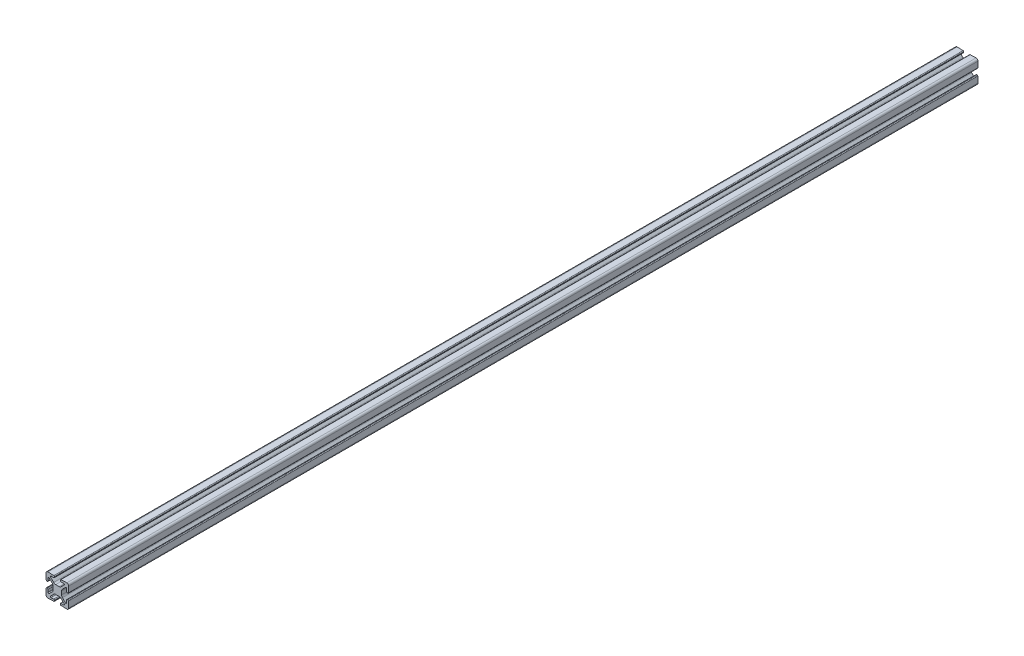
from build123d import *

# Parameters (mm, degrees)
BOSS_EXTRUDE1_DEPTH = 457.2
CIRPATTERN1_COUNT   = 4
BOSS_EXTRUDE2_START = 101.6
BOSS_EXTRUDE2_DEPTH = 101.6


with BuildPart() as part:
    # Sketch3 → Boss-Extrude1 (new, symmetric)
    with BuildSketch(Plane.XY):
        with BuildLine():
            Line((0, 4.7625), (-1.884807374, 4.7625))
            ThreePointArc((-1.884807374, 4.7625), (-3.099827272, 5.004182484), (-4.129871405, 5.69243597))
            Line((-4.129871405, 5.69243597), (-7.599623114, 9.162187679))
            ThreePointArc((-7.599623114, 9.162187679), (-7.759888701, 10.006330839), (-7.033220609, 10.464824259))
            Line((-7.033220609, 10.464824259), (-4.047481702, 10.360559959))
            ThreePointArc((-4.047481702, 10.360559959), (-3.501205536, 10.564804249), (-3.259352476, 11.095502353))
            Line((-3.259352476, 11.095502353), (-3.23896419, 11.679346474))
            ThreePointArc((-3.23896419, 11.679346474), (-3.443208479, 12.225622641), (-3.973906584, 12.467475701))
            Line((-3.973906584, 12.467475701), (-10.597084223, 12.698762161))
            ThreePointArc((-10.597084223, 12.698762161), (-12.104840979, 12.104840979), (-12.698762161, 10.597084223))
            Line((-12.698762161, 10.597084223), (-12.467475701, 3.973906584))
            ThreePointArc((-12.467475701, 3.973906584), (-12.225622641, 3.443208479), (-11.679346474, 3.23896419))
            Line((-11.679346474, 3.23896419), (-11.095502353, 3.259352476))
            ThreePointArc((-11.095502353, 3.259352476), (-10.564804249, 3.501205536), (-10.360559959, 4.047481702))
            Line((-10.360559959, 4.047481702), (-10.464824259, 7.033220609))
            ThreePointArc((-10.464824259, 7.033220609), (-10.006330839, 7.759888701), (-9.162187679, 7.599623114))
            Line((-9.162187679, 7.599623114), (-5.69243597, 4.129871405))
            ThreePointArc((-5.69243597, 4.129871405), (-5.004182484, 3.099827272), (-4.7625, 1.884807374))
            Line((-4.7625, 1.884807374), (-4.7625, 0))
            Line((-4.7625, 0), (-2.54, 0))
            ThreePointArc((-2.54, 0), (-1.796051224, 1.796051224), (0, 2.54))
            Line((0, 2.54), (0, 4.7625))
        make_face()
    boss_extrude1 = extrude(amount=BOSS_EXTRUDE1_DEPTH, both=True)

    # CirPattern1: Boss-Extrude1 ×4 about axis
    cirpattern1_axis = Axis((0, 0, 0), (0, 0, 1))
    for i in range(1, CIRPATTERN1_COUNT):
        add(boss_extrude1.rotate(cirpattern1_axis, i * 360 / CIRPATTERN1_COUNT))

    # Sketch4 → Boss-Extrude2 (add)
    with BuildSketch(Plane.XY.offset(457.2).offset(BOSS_EXTRUDE2_START)):
        with BuildLine():
            Line((1.884807374, 4.7625), (-1.884807374, 4.7625))
            ThreePointArc((-1.884807374, 4.7625), (-3.099827272, 5.004182484), (-4.129871405, 5.69243597))
            Line((-4.129871405, 5.69243597), (-7.599623114, 9.162187679))
            ThreePointArc((-7.599623114, 9.162187679), (-7.759888701, 10.006330839), (-7.033220609, 10.464824259))
            Line((-7.033220609, 10.464824259), (-4.047481702, 10.360559959))
            ThreePointArc((-4.047481702, 10.360559959), (-3.501205536, 10.564804249), (-3.259352476, 11.095502353))
            Line((-3.259352476, 11.095502353), (-3.23896419, 11.679346474))
            ThreePointArc((-3.23896419, 11.679346474), (-3.443208479, 12.225622641), (-3.973906584, 12.467475701))
            Line((-3.973906584, 12.467475701), (-10.597084223, 12.698762161))
            ThreePointArc((-10.597084223, 12.698762161), (-12.104840979, 12.104840979), (-12.698762161, 10.597084223))
            Line((-12.698762161, 10.597084223), (-12.467475701, 3.973906584))
            ThreePointArc((-12.467475701, 3.973906584), (-12.225622641, 3.443208479), (-11.679346474, 3.23896419))
            Line((-11.679346474, 3.23896419), (-11.095502353, 3.259352476))
            ThreePointArc((-11.095502353, 3.259352476), (-10.564804249, 3.501205536), (-10.360559959, 4.047481702))
            Line((-10.360559959, 4.047481702), (-10.464824259, 7.033220609))
            ThreePointArc((-10.464824259, 7.033220609), (-10.006330839, 7.759888701), (-9.162187679, 7.599623114))
            Line((-9.162187679, 7.599623114), (-5.69243597, 4.129871405))
            ThreePointArc((-5.69243597, 4.129871405), (-5.004182484, 3.099827272), (-4.7625, 1.884807374))
            Line((-4.7625, 1.884807374), (-4.7625, -1.884807374))
            ThreePointArc((-4.7625, -1.884807374), (-5.004182484, -3.099827272), (-5.69243597, -4.129871405))
            Line((-5.69243597, -4.129871405), (-9.162187679, -7.599623114))
            ThreePointArc((-9.162187679, -7.599623114), (-10.006330839, -7.759888701), (-10.464824259, -7.033220609))
            Line((-10.464824259, -7.033220609), (-10.360559959, -4.047481702))
            ThreePointArc((-10.360559959, -4.047481702), (-10.564804249, -3.501205536), (-11.095502353, -3.259352476))
            Line((-11.095502353, -3.259352476), (-11.679346474, -3.23896419))
            ThreePointArc((-11.679346474, -3.23896419), (-12.225622641, -3.443208479), (-12.467475701, -3.973906584))
            Line((-12.467475701, -3.973906584), (-12.698762161, -10.597084223))
            ThreePointArc((-12.698762161, -10.597084223), (-12.104840979, -12.104840979), (-10.597084223, -12.698762161))
            Line((-10.597084223, -12.698762161), (-3.973906584, -12.467475701))
            ThreePointArc((-3.973906584, -12.467475701), (-3.443208479, -12.225622641), (-3.23896419, -11.679346474))
            Line((-3.23896419, -11.679346474), (-3.259352476, -11.095502353))
            ThreePointArc((-3.259352476, -11.095502353), (-3.501205536, -10.564804249), (-4.047481702, -10.360559959))
            Line((-4.047481702, -10.360559959), (-7.033220609, -10.464824259))
            ThreePointArc((-7.033220609, -10.464824259), (-7.759888701, -10.006330839), (-7.599623114, -9.162187679))
            Line((-7.599623114, -9.162187679), (-4.129871405, -5.69243597))
            ThreePointArc((-4.129871405, -5.69243597), (-3.099827272, -5.004182484), (-1.884807374, -4.7625))
            Line((-1.884807374, -4.7625), (1.884807374, -4.7625))
            ThreePointArc((1.884807374, -4.7625), (3.099827272, -5.004182484), (4.129871405, -5.69243597))
            Line((4.129871405, -5.69243597), (7.599623114, -9.162187679))
            ThreePointArc((7.599623114, -9.162187679), (7.759888701, -10.006330839), (7.033220609, -10.464824259))
            Line((7.033220609, -10.464824259), (4.047481702, -10.360559959))
            ThreePointArc((4.047481702, -10.360559959), (3.501205536, -10.564804249), (3.259352476, -11.095502353))
            Line((3.259352476, -11.095502353), (3.23896419, -11.679346474))
            ThreePointArc((3.23896419, -11.679346474), (3.443208479, -12.225622641), (3.973906584, -12.467475701))
            Line((3.973906584, -12.467475701), (10.597084223, -12.698762161))
            ThreePointArc((10.597084223, -12.698762161), (12.104840979, -12.104840979), (12.698762161, -10.597084223))
            Line((12.698762161, -10.597084223), (12.467475701, -3.973906584))
            ThreePointArc((12.467475701, -3.973906584), (12.225622641, -3.443208479), (11.679346474, -3.23896419))
            Line((11.679346474, -3.23896419), (11.095502353, -3.259352476))
            ThreePointArc((11.095502353, -3.259352476), (10.564804249, -3.501205536), (10.360559959, -4.047481702))
            Line((10.360559959, -4.047481702), (10.464824259, -7.033220609))
            ThreePointArc((10.464824259, -7.033220609), (10.006330839, -7.759888701), (9.162187679, -7.599623114))
            Line((9.162187679, -7.599623114), (5.69243597, -4.129871405))
            ThreePointArc((5.69243597, -4.129871405), (5.004182484, -3.099827272), (4.7625, -1.884807374))
            Line((4.7625, -1.884807374), (4.7625, 1.884807374))
            ThreePointArc((4.7625, 1.884807374), (5.004182484, 3.099827272), (5.69243597, 4.129871405))
            Line((5.69243597, 4.129871405), (9.162187679, 7.599623114))
            ThreePointArc((9.162187679, 7.599623114), (10.006330839, 7.759888701), (10.464824259, 7.033220609))
            Line((10.464824259, 7.033220609), (10.360559959, 4.047481702))
            ThreePointArc((10.360559959, 4.047481702), (10.564804249, 3.501205536), (11.095502353, 3.259352476))
            Line((11.095502353, 3.259352476), (11.679346474, 3.23896419))
            ThreePointArc((11.679346474, 3.23896419), (12.225622641, 3.443208479), (12.467475701, 3.973906584))
            Line((12.467475701, 3.973906584), (12.698762161, 10.597084223))
            ThreePointArc((12.698762161, 10.597084223), (12.104840979, 12.104840979), (10.597084223, 12.698762161))
            Line((10.597084223, 12.698762161), (3.973906584, 12.467475701))
            ThreePointArc((3.973906584, 12.467475701), (3.443208479, 12.225622641), (3.23896419, 11.679346474))
            Line((3.23896419, 11.679346474), (3.259352476, 11.095502353))
            ThreePointArc((3.259352476, 11.095502353), (3.501205536, 10.564804249), (4.047481702, 10.360559959))
            Line((4.047481702, 10.360559959), (7.033220609, 10.464824259))
            ThreePointArc((7.033220609, 10.464824259), (7.759888701, 10.006330839), (7.599623114, 9.162187679))
            Line((7.599623114, 9.162187679), (4.129871405, 5.69243597))
            ThreePointArc((4.129871405, 5.69243597), (3.099827272, 5.004182484), (1.884807374, 4.7625))
        make_face()
    extrude(amount=-BOSS_EXTRUDE2_DEPTH)


solid = part.part
